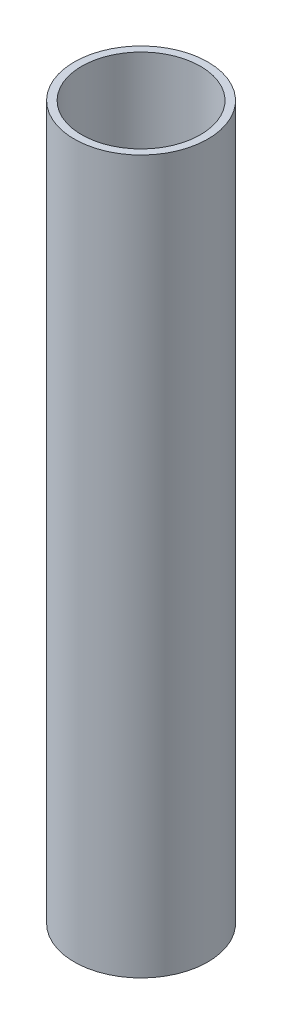
from build123d import *

# Parameters (mm, degrees)
SKETCH_1_R      = 57.15
SKETCH_1_R_2    = 50.8
EXTRUDE_1_DEPTH = 609.6


with BuildPart() as part:
    # 草图1 → 凸台-拉伸1 (new body)
    with BuildSketch(Plane(origin=(0, 0, 0), x_dir=(1, 0, 0), z_dir=(0, 1, 0))):
        with Locations(Location((0, 0, 0), (0, 0, 90))):
            Circle(SKETCH_1_R)
        with Locations(Location((0, 0, 0), (0, 0, 90))):
            Circle(SKETCH_1_R_2, mode=Mode.SUBTRACT)
    extrude(amount=EXTRUDE_1_DEPTH)


solid = part.part
